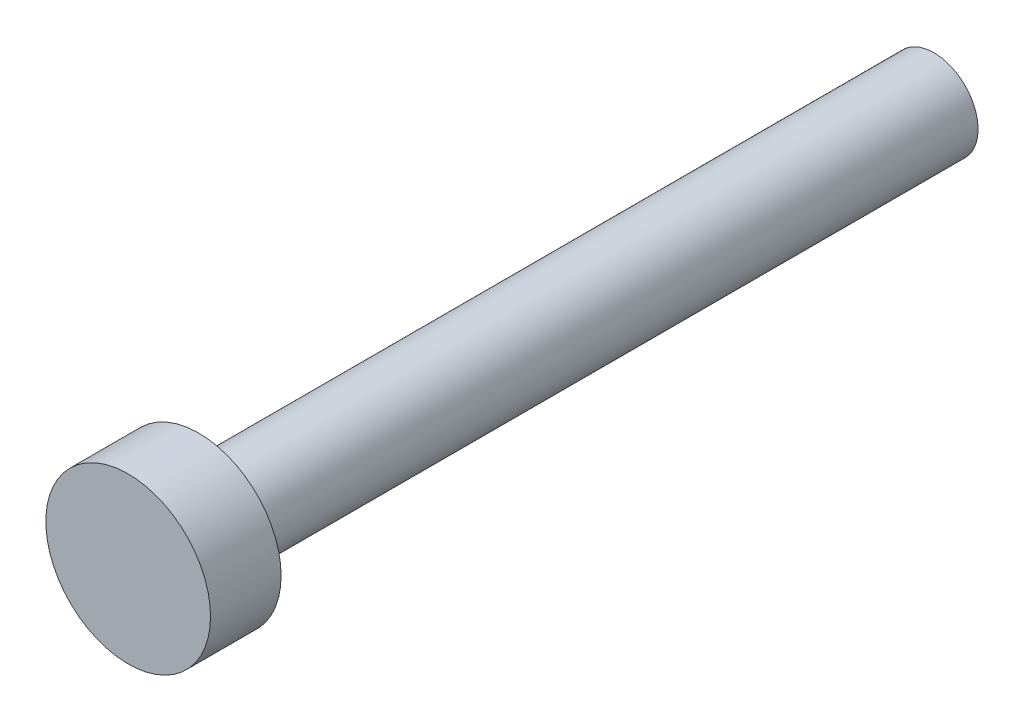
from build123d import *

# Parameters (mm, degrees)
ESQUISSE1_R        = 2.8
BOSS_EXTRU_1_DEPTH = 2.4
ESQUISSE2_R        = 1.5
BOSS_EXTRU_2_DEPTH = 25


with BuildPart() as part:
    # Esquisse1 → Boss.-Extru.1 (new body)
    with BuildSketch(Plane.XY):
        Circle(ESQUISSE1_R)
    extrude(amount=BOSS_EXTRU_1_DEPTH)

    # Esquisse2 → Boss.-Extru.2 (add)
    with BuildSketch(Plane(origin=(0, 0, 0), x_dir=(-1, 0, 0), z_dir=(0, 0, -1))):
        Circle(ESQUISSE2_R)
    extrude(amount=BOSS_EXTRU_2_DEPTH)


solid = part.part
